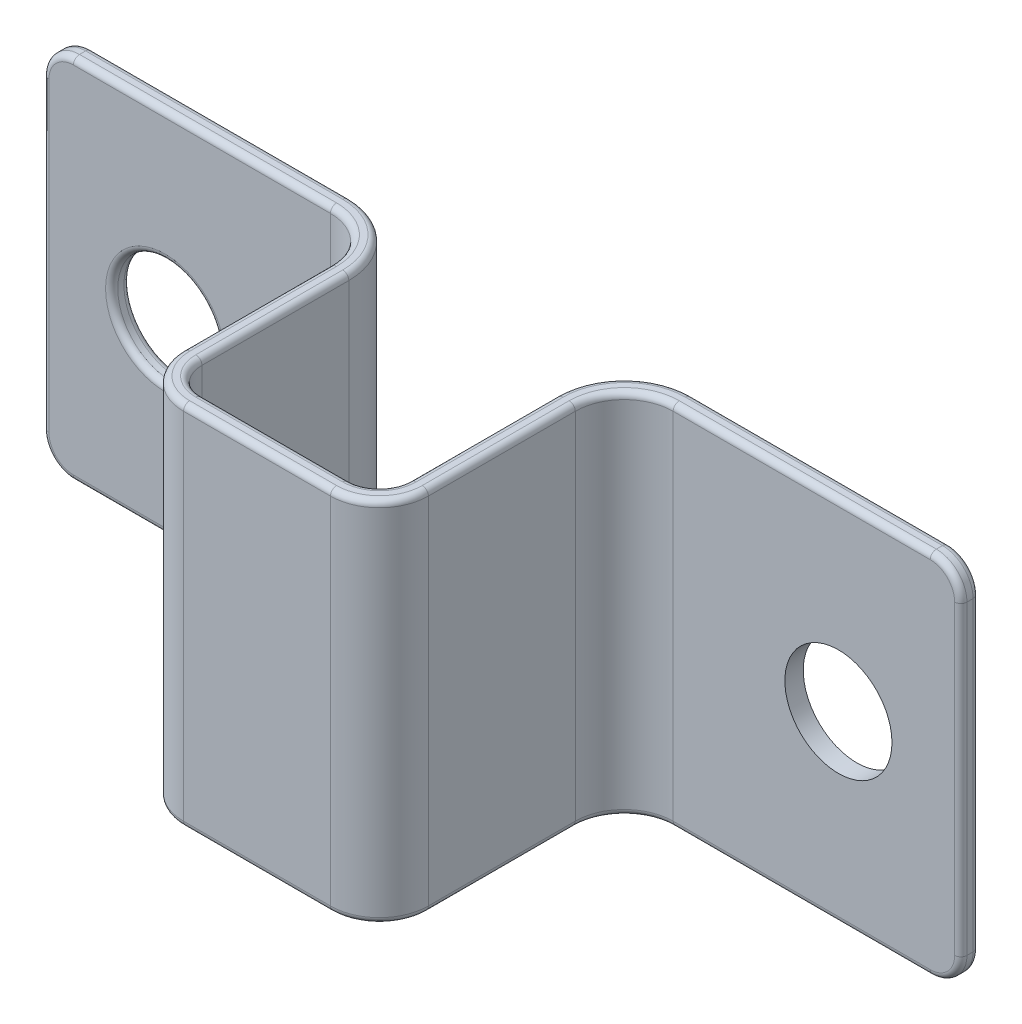
from build123d import *

# Parameters (mm, degrees)
EXTRUDE_1_DEPTH     = 6
SKETCH_2_R          = 1.75
CUT_EXTRUDE_1_DEPTH = 0.6
FILLET_1_R          = 1
FILLET_2_R          = 1.6
FILLET_3_R          = 1.6
FILLET_4_R          = 2.2
FILLET_5_R          = 1
FILLET_6_R          = 0.2


with BuildPart() as part:
    # 草图1 → 凸台-拉伸1 (new, symmetric)
    with BuildSketch(Plane(origin=(0, 0, 0), x_dir=(1, 0, 0), z_dir=(0, 1, 0))):
        Polygon((-15, 0), (-4, 0), (-4, -8), (4, -8), (4, 0), (15, 0), (15, 0.6), (3.4, 0.6), (3.4, -7.4), (-3.4, -7.4), (-3.4, 0.6), (-15, 0.6), align=None)
    extrude(amount=EXTRUDE_1_DEPTH, both=True)

    # 草图2 → 切除-拉伸1 (cut)
    with BuildSketch(Plane.XY):
        with Locations((-11, 0)):
            Circle(SKETCH_2_R)
        with Locations((11, 0)):
            Circle(SKETCH_2_R)
    extrude(amount=-CUT_EXTRUDE_1_DEPTH, mode=Mode.SUBTRACT)

    # 圆角1
    fillet_1_edges = [part.edges().sort_by_distance(p)[0] for p in [
        (-3.4, 0, 7.4),
        (3.4, 0, 7.4),
    ]]
    fillet(fillet_1_edges, radius=FILLET_1_R)

    # 圆角2
    fillet_2_edges = [part.edges().sort_by_distance(p)[0] for p in [
        (4, 0, 8),
        (-4, 0, 8),
    ]]
    fillet(fillet_2_edges, radius=FILLET_2_R)

    # 圆角3
    fillet_3_edges = [part.edges().sort_by_distance(p)[0] for p in [
        (4, 0, 0),
        (-4, 0, 0),
    ]]
    fillet(fillet_3_edges, radius=FILLET_3_R)

    # 圆角4
    fillet_4_edges = [part.edges().sort_by_distance(p)[0] for p in [
        (-3.4, 0, -0.6),
        (3.4, 0, -0.6),
    ]]
    fillet(fillet_4_edges, radius=FILLET_4_R)

    # 圆角5
    fillet_5_edges = [part.edges().sort_by_distance(p)[0] for p in [
        (15, -6, -0.3),
        (-15, -6, -0.3),
        (15, 6, -0.3),
        (-15, 6, -0.3),
    ]]
    fillet(fillet_5_edges, radius=FILLET_5_R)

    # 圆角6
    fillet_6_edges = [part.edges().sort_by_distance(p)[0] for p in [
        (9.8, -6, -0.6),
        (15, 0, -0.6),
        (15, 0, 0),
        (14.707106781, 5.707106781, -0.6),
        (14.707106781, -5.707106781, -0.6),
        (14.707106781, 5.707106781, 0),
        (14.707106781, -5.707106781, 0),
        (-12.75, 0, 0),
        (-12.75, 0, -0.6),
        (0, -6, 7.4),
        (0, 6, 7.4),
        (-3.4, -6, 4),
        (-3.4, 6, 4),
        (3.107106781, -6, 7.107106781),
        (3.107106781, 6, 7.107106781),
        (-3.107106781, -6, 7.107106781),
        (-3.107106781, 6, 7.107106781),
        (4, -6, 4),
        (4, 6, 4),
        (0, -6, 8),
        (-3.53137085, -6, 7.53137085),
        (3.53137085, -6, 7.53137085),
        (0, 6, 8),
        (-3.53137085, 6, 7.53137085),
        (3.53137085, 6, 7.53137085),
        (9.8, -6, 0),
        (9.8, 6, 0),
        (-4, -6, 4),
        (-4, 6, 4),
        (4.46862915, -6, 0.46862915),
        (4.46862915, 6, 0.46862915),
        (-4.46862915, -6, 0.46862915),
        (-4.46862915, 6, 0.46862915),
        (3.4, -6, 4),
        (3.4, 6, 4),
        (-9.8, -6, -0.6),
        (-4.044365081, -6, 0.044365081),
        (4.044365081, -6, 0.044365081),
        (-9.8, 6, -0.6),
        (-4.044365081, 6, 0.044365081),
        (4.044365081, 6, 0.044365081),
        (9.8, 6, -0.6),
        (-9.8, 6, 0),
        (-9.8, -6, 0),
        (-15, 0, 0),
        (-14.707106781, -5.707106781, 0),
        (-14.707106781, 5.707106781, 0),
        (-15, 0, -0.6),
        (-14.707106781, -5.707106781, -0.6),
        (-14.707106781, 5.707106781, -0.6),
    ]]
    fillet(fillet_6_edges, radius=FILLET_6_R)


solid = part.part
